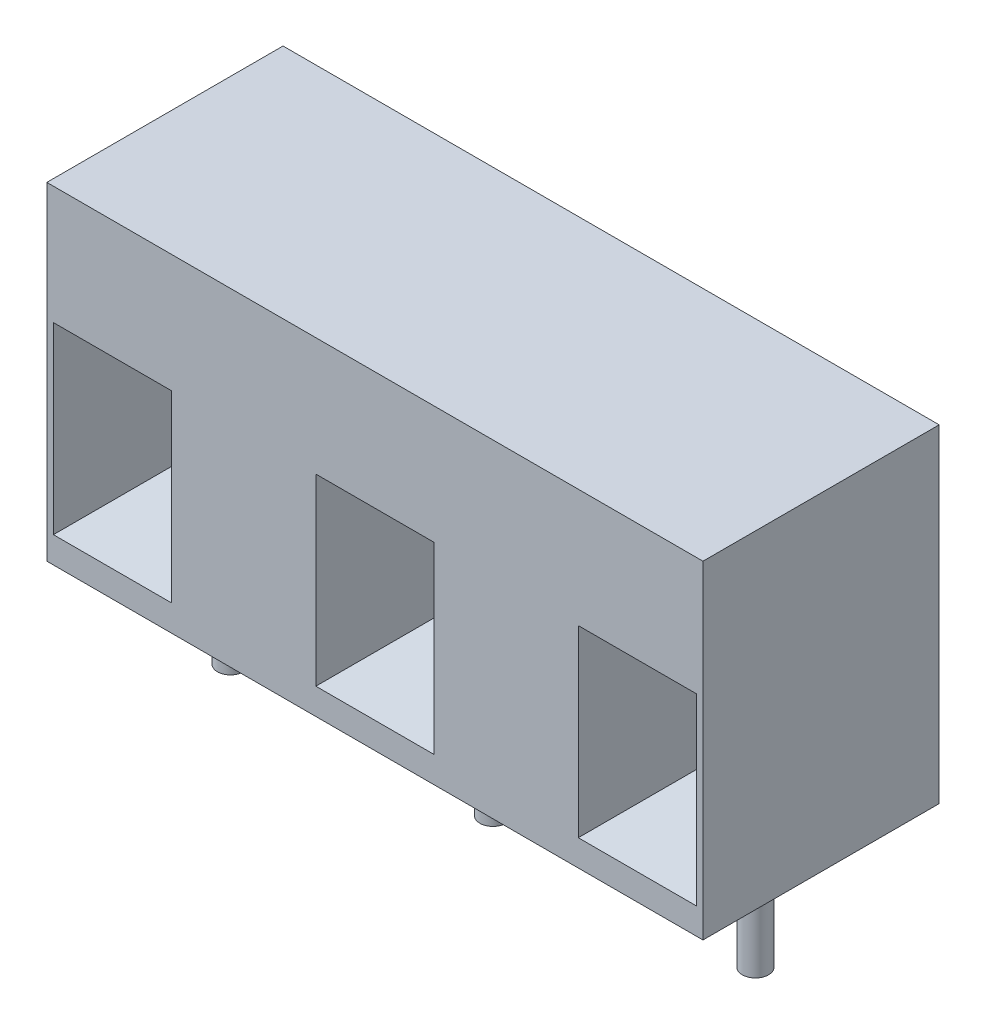
from build123d import *

# Parameters (mm, degrees)
SKETCH1_W                    = 25
SKETCH1_H                    = 9
BOSS_EXTRUDE1_DEPTH          = 12.5
SKETCH2_R                    = 0.5
BOSS_EXTRUDE2_DEPTH          = 4.4
SKETCH3_W                    = 4.5
SKETCH3_H                    = 7
CUT_EXTRUDE1_DEPTH           = 4.4
CUT_EXTRUDE1_DRAFT           = -15
CUT_EXTRUDE1_PROFILE_2_DEPTH = 4.4
CUT_EXTRUDE1_PROFILE_2_DRAFT = -15
CUT_EXTRUDE1_PROFILE_3_DEPTH = 4.4
CUT_EXTRUDE1_PROFILE_3_DRAFT = -15


with BuildPart() as part:
    # Sketch1 → Boss-Extrude1 (new body)
    with BuildSketch(Plane(origin=(0, 0, 0), x_dir=(1, 0, 0), z_dir=(0, 1, 0))):
        Rectangle(SKETCH1_W, SKETCH1_H)
    extrude(amount=BOSS_EXTRUDE1_DEPTH)

    # Sketch2 → Boss-Extrude2 (add)
    with BuildSketch(Plane.XZ):
        with Locations(Location((0, 0, 0), (0, 0, 270))):
            Circle(SKETCH2_R)
        with Locations(Location((-10, 0, 0), (0, 0, 270))):
            Circle(SKETCH2_R)
        with Locations(Location((10, 0, 0), (0, 0, 270))):
            Circle(SKETCH2_R)
    extrude(amount=BOSS_EXTRUDE2_DEPTH)


with BuildPart() as cut_extrude1_tool:
    # Sketch3 → Cut-Extrude1 (with draft: the straight prism first)
    with BuildSketch(Plane.XY.offset(4.5)):
        with Locations((0, 4.5)):
            Rectangle(SKETCH3_W, SKETCH3_H)
    extrude(amount=-CUT_EXTRUDE1_DEPTH)
    # Cut-Extrude1: the draft: its side faces are tilted about the plane it starts from
    cut_extrude1_sides = [cut_extrude1_tool.faces().sort_by_distance(p)[0] for p in [
        (0, 1, 2.3),
        (2.25, 4.5, 2.3),
        (0, 8, 2.3),
        (-2.25, 4.5, 2.3),
    ]]
    draft(cut_extrude1_sides, Plane.XY.offset(4.5), CUT_EXTRUDE1_DRAFT)


with BuildPart() as part_1:
    add(part.part)

    # Cut-Extrude1: cut by cut_extrude1_tool
    add(cut_extrude1_tool.part, mode=Mode.SUBTRACT)


with BuildPart() as cut_extrude1_profile_2_tool:
    # Sketch3 → Cut-Extrude1 profile 2 (with draft: the straight prism first)
    with BuildSketch(Plane.XY.offset(4.5)):
        with Locations((10, 4.5)):
            Rectangle(SKETCH3_W, SKETCH3_H)
    extrude(amount=-CUT_EXTRUDE1_PROFILE_2_DEPTH)
    # Cut-Extrude1 profile 2: the draft: its side faces are tilted about the plane it starts from
    cut_extrude1_profile_2_sides = [cut_extrude1_profile_2_tool.faces().sort_by_distance(p)[0] for p in [
        (10, 1, 2.3),
        (12.25, 4.5, 2.3),
        (10, 8, 2.3),
        (7.75, 4.5, 2.3),
    ]]
    draft(cut_extrude1_profile_2_sides, Plane.XY.offset(4.5), CUT_EXTRUDE1_PROFILE_2_DRAFT)


with BuildPart() as part_2:
    add(part_1.part)

    # Cut-Extrude1 profile 2: cut by cut_extrude1_profile_2_tool
    add(cut_extrude1_profile_2_tool.part, mode=Mode.SUBTRACT)


with BuildPart() as cut_extrude1_profile_3_tool:
    # Sketch3 → Cut-Extrude1 profile 3 (with draft: the straight prism first)
    with BuildSketch(Plane.XY.offset(4.5)):
        with Locations((-10, 4.5)):
            Rectangle(SKETCH3_W, SKETCH3_H)
    extrude(amount=-CUT_EXTRUDE1_PROFILE_3_DEPTH)
    # Cut-Extrude1 profile 3: the draft: its side faces are tilted about the plane it starts from
    cut_extrude1_profile_3_sides = [cut_extrude1_profile_3_tool.faces().sort_by_distance(p)[0] for p in [
        (-10, 1, 2.3),
        (-7.75, 4.5, 2.3),
        (-10, 8, 2.3),
        (-12.25, 4.5, 2.3),
    ]]
    draft(cut_extrude1_profile_3_sides, Plane.XY.offset(4.5), CUT_EXTRUDE1_PROFILE_3_DRAFT)


with BuildPart() as part_3:
    add(part_2.part)

    # Cut-Extrude1 profile 3: cut by cut_extrude1_profile_3_tool
    add(cut_extrude1_profile_3_tool.part, mode=Mode.SUBTRACT)


solid = part_3.part
